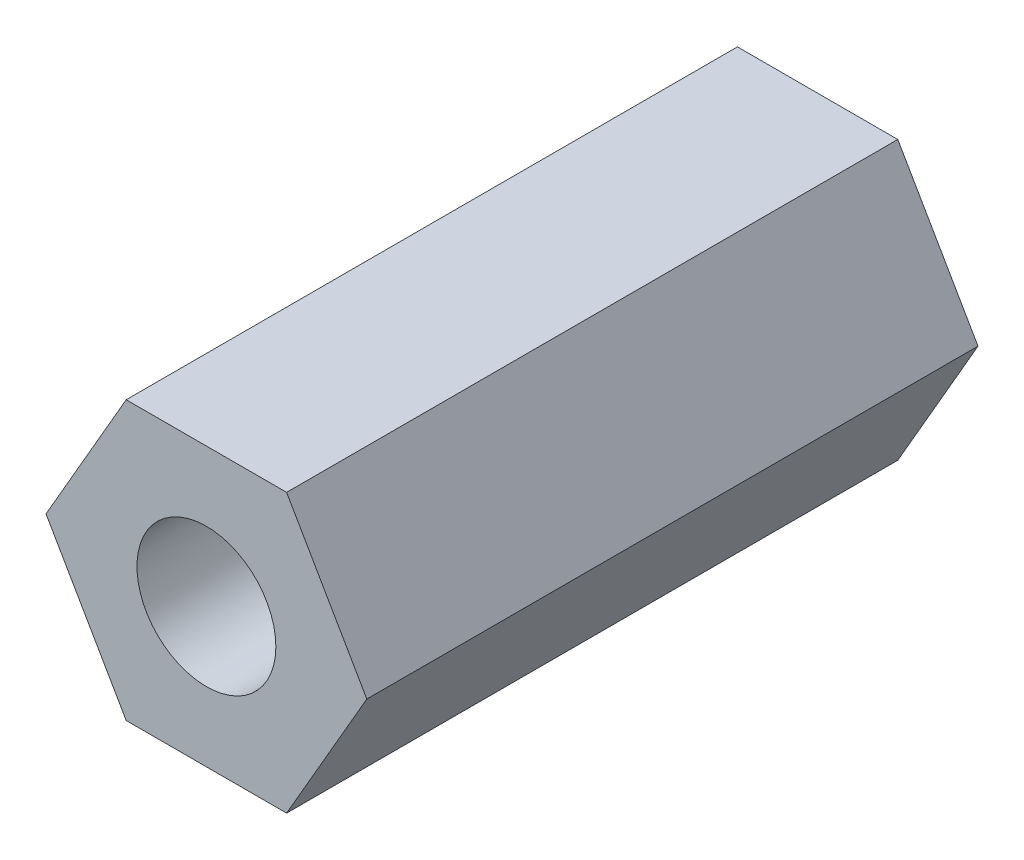
from build123d import *

# Parameters (mm, degrees)
SKETCH1_R   = 1.25
HEX_2_DEPTH = 11


with BuildPart() as part:
    # Sketch1 → Hex 2 (new body)
    with BuildSketch(Plane.XY):
        Polygon((2.886751346, 0), (1.443375673, 2.5), (-1.443375673, 2.5), (-2.886751346, 0), (-1.443375673, -2.5), (1.443375673, -2.5), align=None)
        Circle(SKETCH1_R, mode=Mode.SUBTRACT)
    extrude(amount=HEX_2_DEPTH)


solid = part.part
